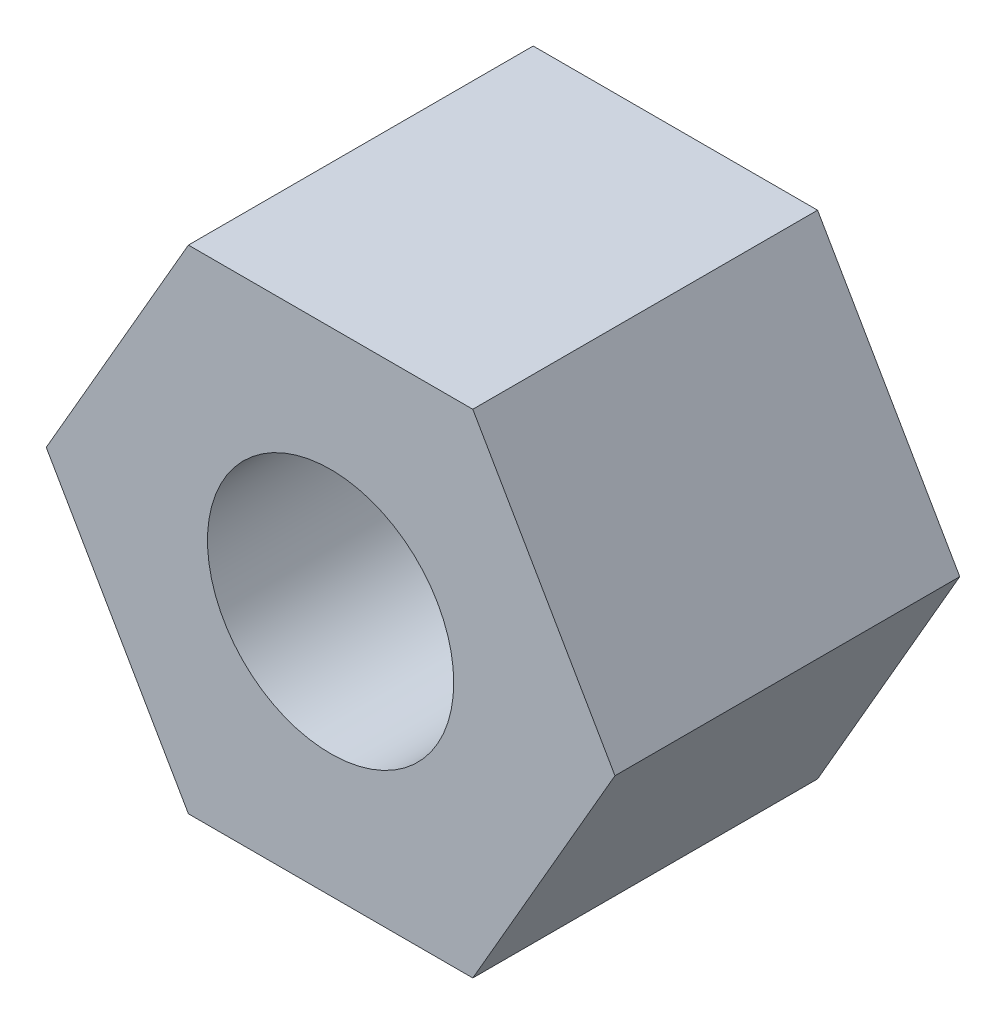
from build123d import *

# Parameters (mm, degrees)
ACROSS_FLATS_5_R                     = 1.25
NUT_THREAD_ENVELOPE_HEIGHT_3_5_DEPTH = 3.5


with BuildPart() as part:
    # Across_flats_5 → Nut_thread_envelope_height_3.5 (new body)
    with BuildSketch(Plane.XY):
        Polygon((2.886751346, 0), (1.443375673, 2.5), (-1.443375673, 2.5), (-2.886751346, 0), (-1.443375673, -2.5), (1.443375673, -2.5), align=None)
        Circle(ACROSS_FLATS_5_R, mode=Mode.SUBTRACT)
    extrude(amount=NUT_THREAD_ENVELOPE_HEIGHT_3_5_DEPTH)


solid = part.part
